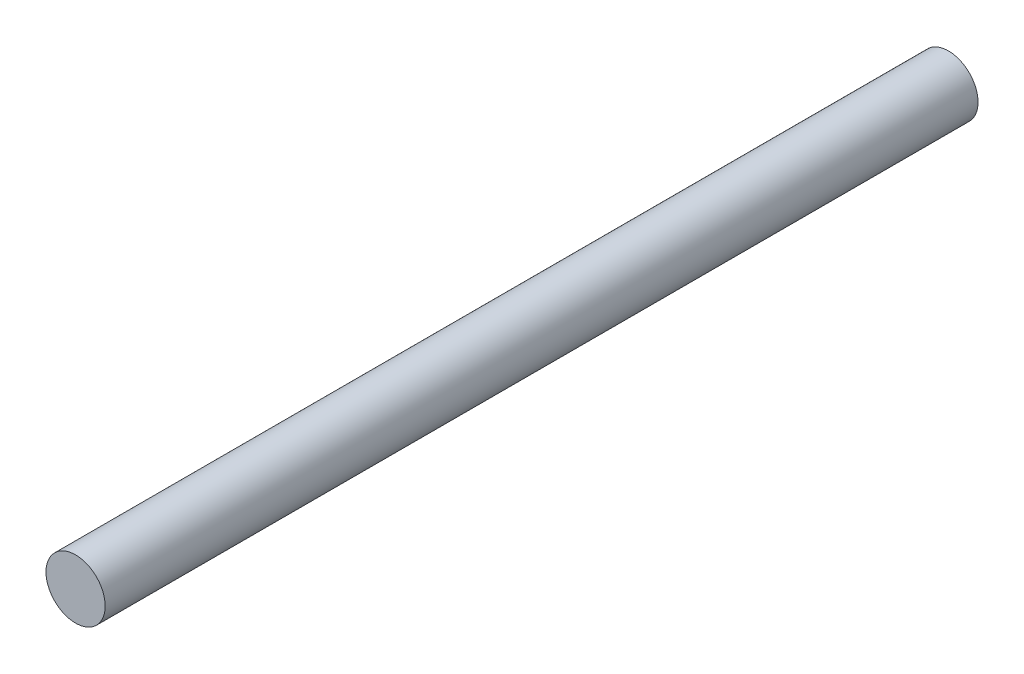
from build123d import *

# Parameters (mm, degrees)
SKETCH1_R           = 2
BOSS_EXTRUDE1_DEPTH = 59


with BuildPart() as part:
    # Sketch1 → Boss-Extrude1 (new body)
    with BuildSketch(Plane.XY):
        with Locations(Location((-25.269255485, 4.156450879, 0), (0, 0, 180))):
            Circle(SKETCH1_R)
    extrude(amount=BOSS_EXTRUDE1_DEPTH)


solid = part.part
